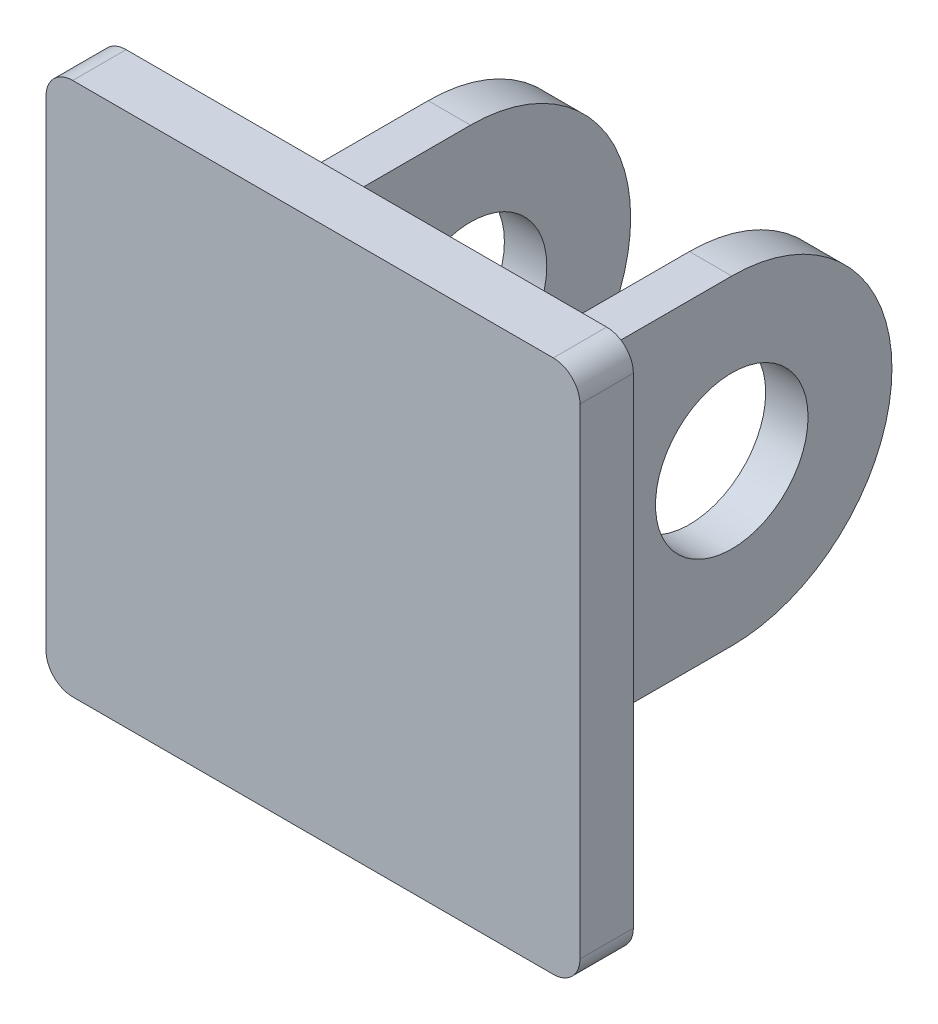
from build123d import *

# Parameters (mm, degrees)
SKETCH2_W           = 100
SKETCH2_H           = 100
BOSS_EXTRUDE1_DEPTH = 10
SKETCH3_R           = 14.2875
BOSS_EXTRUDE2_DEPTH = 7.9375
FILLET1_R           = 5


with BuildPart() as part:
    # Sketch2 → Boss-Extrude1 (new body)
    with BuildSketch(Plane.XY):
        Rectangle(SKETCH2_W, SKETCH2_H)
    extrude(amount=BOSS_EXTRUDE1_DEPTH)

    # Sketch3 → Boss-Extrude2 (add)
    with BuildSketch(Plane(origin=(20.5, 0, 0), x_dir=(0, 0, -1), z_dir=(1, 0, 0))):
        with BuildLine():
            Line((0, 30), (40, 30))
            ThreePointArc((40, 30), (70, 0), (40, -30))
            Line((40, -30), (0, -30))
            Line((0, -30), (0, 30))
        make_face()
        with Locations((40, 0)):
            Circle(SKETCH3_R, mode=Mode.SUBTRACT)
    boss_extrude2 = extrude(amount=BOSS_EXTRUDE2_DEPTH)

    # Mirror1: Boss-Extrude2 across plane
    add(boss_extrude2.mirror(Plane(origin=(0, 0, 0), x_dir=(0, 0, 1), z_dir=(1, 0, 0))))

    # Fillet1
    fillet1_edges = [part.edges().sort_by_distance(p)[0] for p in [
        (-50, -50, 5),
        (-50, 50, 5),
        (50, -50, 5),
        (50, 50, 5),
    ]]
    fillet(fillet1_edges, radius=FILLET1_R)


solid = part.part
